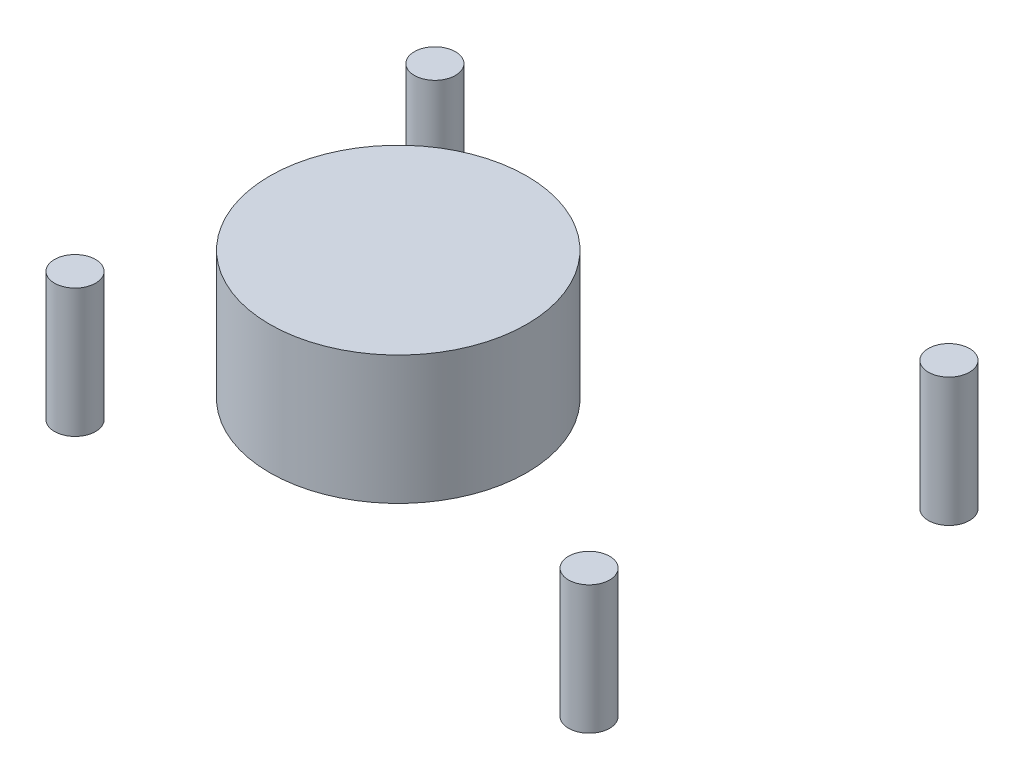
from build123d import *

# Parameters (mm, degrees)
SKETCH1_R             = 1.6
BOSS_EXTRUDE1_DEPTH   = 10
BOSS_EXTRUDE1_2_DEPTH = 10
BOSS_EXTRUDE1_3_DEPTH = 10
BOSS_EXTRUDE1_4_DEPTH = 10
SKETCH1_R_2           = 10
BOSS_EXTRUDE1_5_DEPTH = 10


with BuildPart() as part:
    # Sketch1 → Boss-Extrude1 (new body)
    with BuildSketch(Plane(origin=(0, 0, 0), x_dir=(1, 0, 0), z_dir=(0, 1, 0))):
        with Locations(Location((20.179637899, 38.108385802, 0), (0, 0, 270))):
            Circle(SKETCH1_R)
    extrude(amount=BOSS_EXTRUDE1_DEPTH)


with BuildPart() as body_2:
    # Sketch1 → Boss-Extrude1 2 (new body)
    with BuildSketch(Plane(origin=(0, 0, 0), x_dir=(1, 0, 0), z_dir=(0, 1, 0))):
        with Locations(Location((60.179637899, 38.108385802, 0), (0, 0, 270))):
            Circle(SKETCH1_R)
    extrude(amount=BOSS_EXTRUDE1_2_DEPTH)


with BuildPart() as body_3:
    # Sketch1 → Boss-Extrude1 3 (new body)
    with BuildSketch(Plane(origin=(0, 0, 0), x_dir=(1, 0, 0), z_dir=(0, 1, 0))):
        with Locations(Location((20.179637899, 10.108385802, 0), (0, 0, 270))):
            Circle(SKETCH1_R)
    extrude(amount=BOSS_EXTRUDE1_3_DEPTH)


with BuildPart() as body_4:
    # Sketch1 → Boss-Extrude1 4 (new body)
    with BuildSketch(Plane(origin=(0, 0, 0), x_dir=(1, 0, 0), z_dir=(0, 1, 0))):
        with Locations(Location((60.179637899, 10.108385802, 0), (0, 0, 270))):
            Circle(SKETCH1_R)
    extrude(amount=BOSS_EXTRUDE1_4_DEPTH)


with BuildPart() as body_5:
    # Sketch1 → Boss-Extrude1 5 (new body)
    with BuildSketch(Plane(origin=(0, 0, 0), x_dir=(1, 0, 0), z_dir=(0, 1, 0))):
        with Locations(Location((31.329637899, 24.108385802, 0), (0, 0, 270))):
            Circle(SKETCH1_R_2)
    extrude(amount=BOSS_EXTRUDE1_5_DEPTH)


solid = Compound([part.part, body_2.part, body_3.part, body_4.part, body_5.part])
